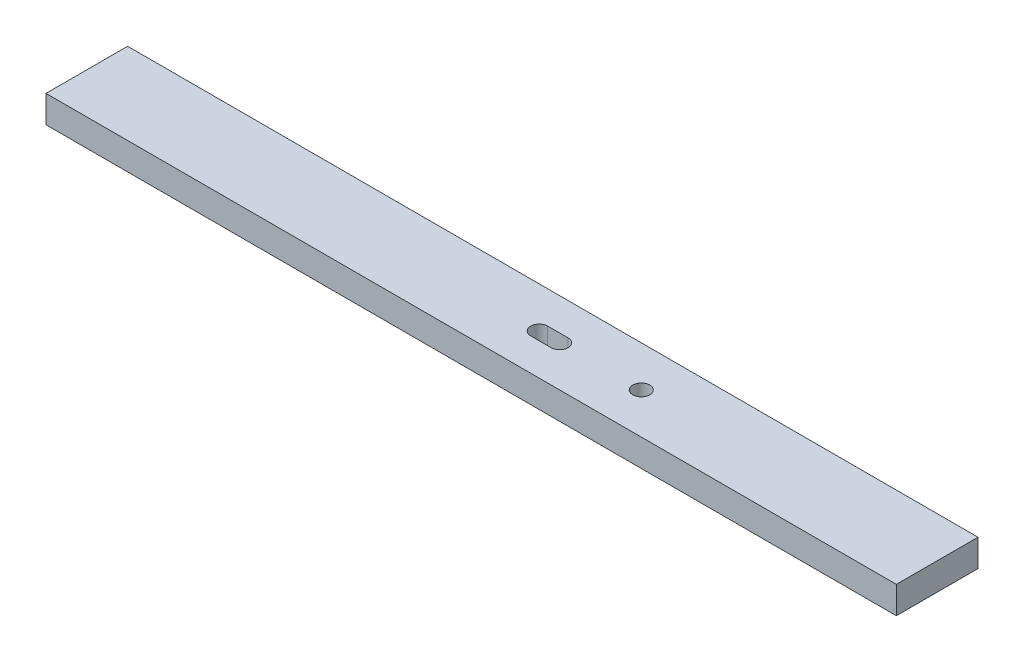
from build123d import *

# Parameters (mm, degrees)
SKETCH_1_W               = 24
SKETCH_1_H               = 8
EXTRUDE_1_DEPTH          = 250
CUT_EXTRUDE_3_DEPTH      = 251.319795462
CUT_EXTRUDE_3_DEPTH_BACK = 251.319795462
SKETCH_2_R               = 2.5


with BuildPart() as part:
    # 草图1 → 凸台-拉伸1 (new body)
    with BuildSketch(Plane(origin=(0, 0, 0), x_dir=(0, 0, -1), z_dir=(1, 0, 0))):
        Rectangle(SKETCH_1_W, SKETCH_1_H)
    extrude(amount=EXTRUDE_1_DEPTH)

    # 草图2 → 切除-拉伸3 (cut, two sides: drawn at the far end of the back side and taken through both)
    with BuildSketch(Plane(origin=(0, 0, 0), x_dir=(1, 0, 0), z_dir=(0, 1, 0)).offset(-CUT_EXTRUDE_3_DEPTH_BACK)):
        with Locations(Location((163, 0, 0), (0, 0, 270))):
            Circle(SKETCH_2_R)
        with BuildLine():
            Line((133, 2.5), (139, 2.5))
            ThreePointArc((139, 2.5), (141.5, 0), (139, -2.5))
            Line((139, -2.5), (133, -2.5))
            ThreePointArc((133, -2.5), (130.5, 0), (133, 2.5))
        make_face()
    extrude(amount=CUT_EXTRUDE_3_DEPTH + CUT_EXTRUDE_3_DEPTH_BACK, mode=Mode.SUBTRACT)


solid = part.part
